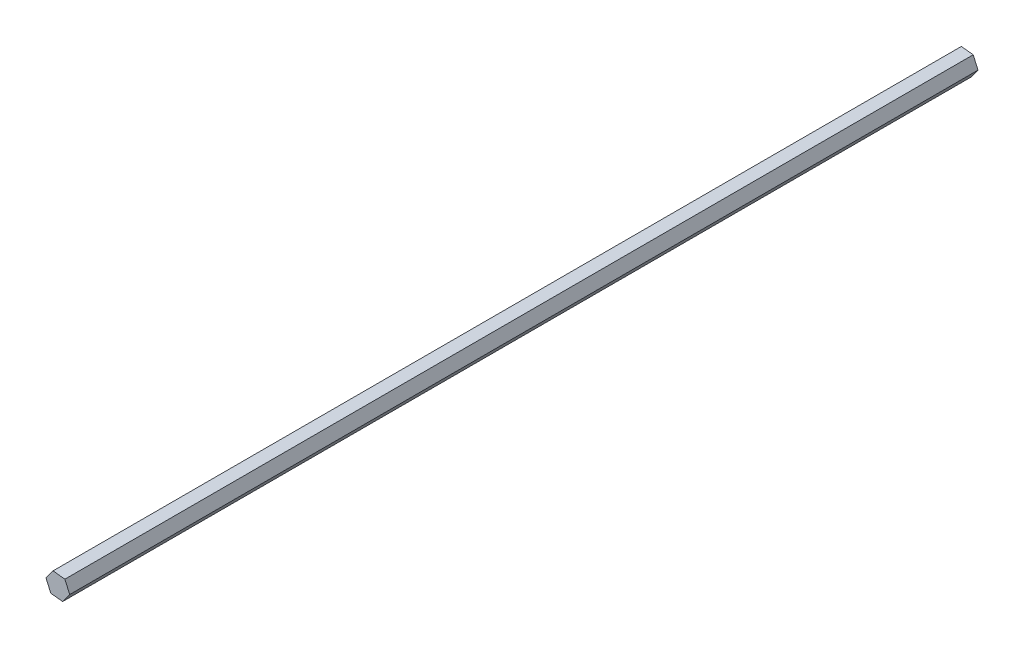
from build123d import *

# Parameters (mm, degrees)
BOSS_EXTRUDE1_DEPTH = 558.8


with BuildPart() as part:
    # Sketch1 → Boss-Extrude1 (new body)
    with BuildSketch(Plane.XY):
        Polygon((4.3343451, 5.914117507), (-2.954603452, 6.710711719), (-7.288948552, 0.796594211), (-4.3343451, -5.914117507), (2.954603452, -6.710711719), (7.288948552, -0.796594211), align=None)
    extrude(amount=BOSS_EXTRUDE1_DEPTH)


solid = part.part
